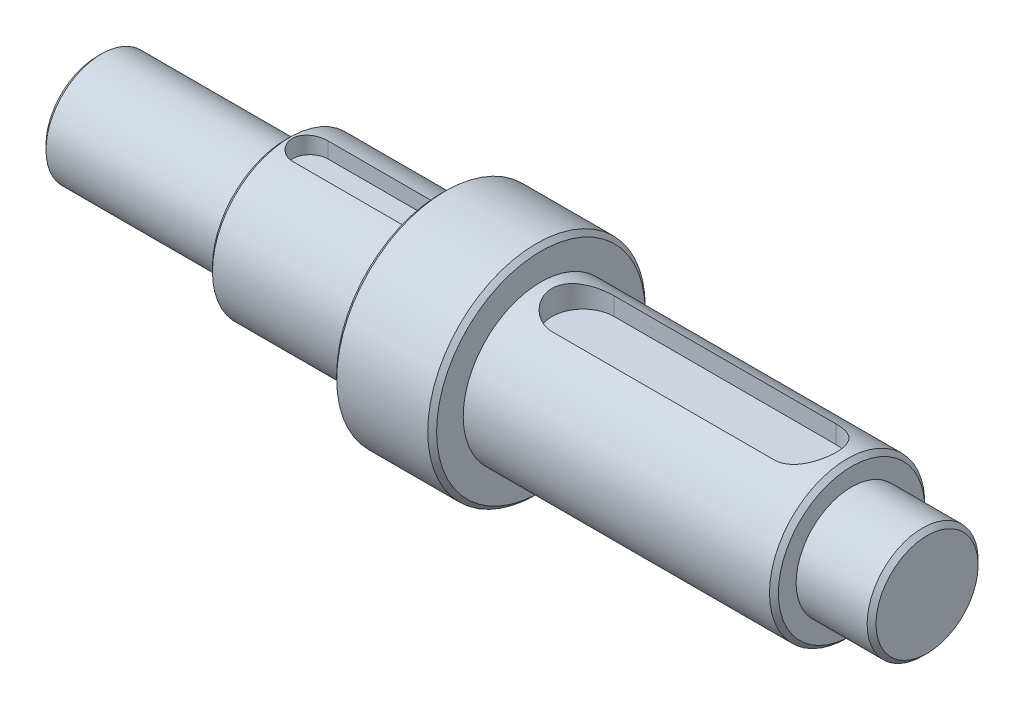
from build123d import *

# Parameters (mm, degrees)
CUT_EXTRUDE1_DEPTH = 4
CUT_EXTRUDE2_DEPTH = 5.5


with BuildPart() as part:
    # Sketch1 → Revolve1 (revolve)
    with BuildSketch(Plane.XY, mode=Mode.PRIVATE) as revolve1_sk:
        Polygon((-68.909512761, 0), (-68.909512761, 11.5), (-67.909512761, 12.5), (-26.409512761, 12.5), (-26.409512761, 16.5), (-25.409512761, 17.5), (8.590487239, 17.5), (8.590487239, 23.5), (9.590487239, 24.5), (30.090487239, 24.5), (31.090487239, 23.5), (31.090487239, 17.5), (100.090487239, 17.5), (101.090487239, 16.5), (101.090487239, 12.5), (117.090487239, 12.5), (118.090487239, 11.5), (118.090487239, 0), align=None)
    revolve(revolve1_sk.sketch.rotate(Axis((-92.22737819, 0, 0), (1, 0, 0)), 90), axis=Axis((-92.22737819, 0, 0), (1, 0, 0)))

    # Sketch2 → Cut-Extrude1 (cut)
    with BuildSketch(Plane(origin=(0, 17.5, 0), x_dir=(1, 0, 0), z_dir=(0, 1, 0))):
        with BuildLine():
            Line((-20.909512761, 4), (4.090487239, 4))
            ThreePointArc((4.090487239, 4), (8.090487239, 0), (4.090487239, -4))
            Line((4.090487239, -4), (-20.909512761, -4))
            ThreePointArc((-20.909512761, -4), (-24.909512761, 0), (-20.909512761, 4))
        make_face()
    extrude(amount=-CUT_EXTRUDE1_DEPTH, mode=Mode.SUBTRACT)

    # Sketch3 → Cut-Extrude2 (cut)
    with BuildSketch(Plane(origin=(0, 17.5, 0), x_dir=(1, 0, 0), z_dir=(0, 1, 0))):
        with BuildLine():
            Line((40.590487239, 7), (90.590487239, 7))
            ThreePointArc((90.590487239, 7), (97.590487239, 0), (90.590487239, -7))
            Line((90.590487239, -7), (40.590487239, -7))
            ThreePointArc((40.590487239, -7), (33.590487239, 0), (40.590487239, 7))
        make_face()
    extrude(amount=-CUT_EXTRUDE2_DEPTH, mode=Mode.SUBTRACT)


solid = part.part
